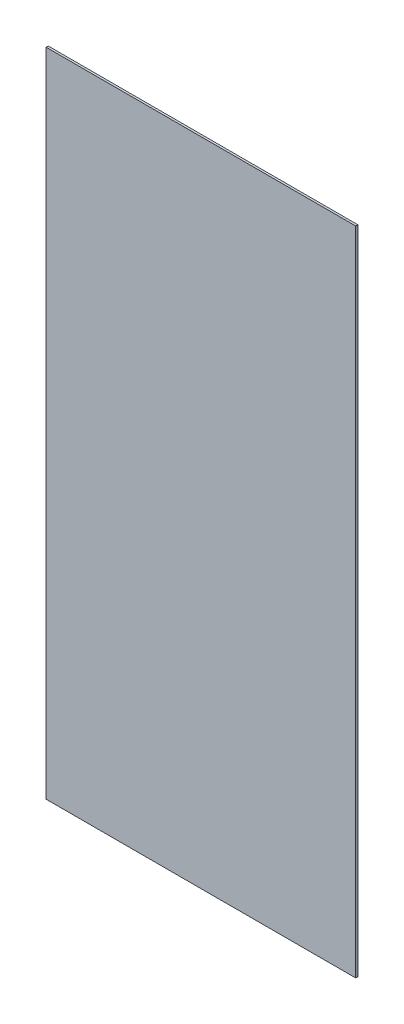
from build123d import *

# Parameters (mm, degrees)
SKETCH1_W           = 290
SKETCH1_H           = 610
BOSS_EXTRUDE1_DEPTH = 2


with BuildPart() as part:
    # Sketch1 → Boss-Extrude1 (new body)
    with BuildSketch(Plane.XY):
        Rectangle(SKETCH1_W, SKETCH1_H)
    extrude(amount=BOSS_EXTRUDE1_DEPTH)


solid = part.part
